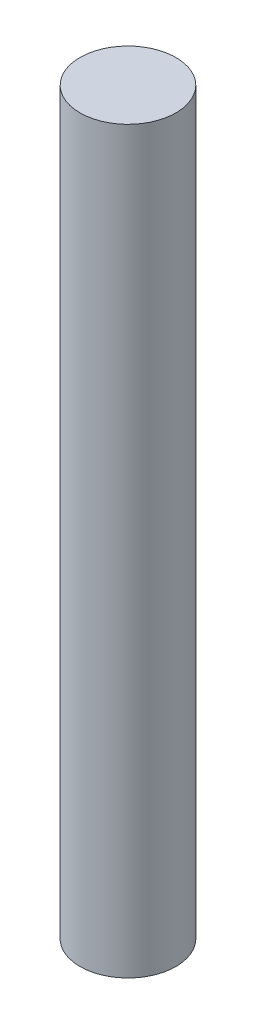
from build123d import *

# Parameters (mm, degrees)
SKETCH1_R           = 4.75
BOSS_EXTRUDE1_DEPTH = 73.2


with BuildPart() as part:
    # Sketch1 → Boss-Extrude1 (new body)
    with BuildSketch(Plane(origin=(0, 0, 0), x_dir=(1, 0, 0), z_dir=(0, 1, 0))):
        with Locations(Location((0, 0, 0), (0, 0, 270))):
            Circle(SKETCH1_R)
    extrude(amount=BOSS_EXTRUDE1_DEPTH)


solid = part.part
